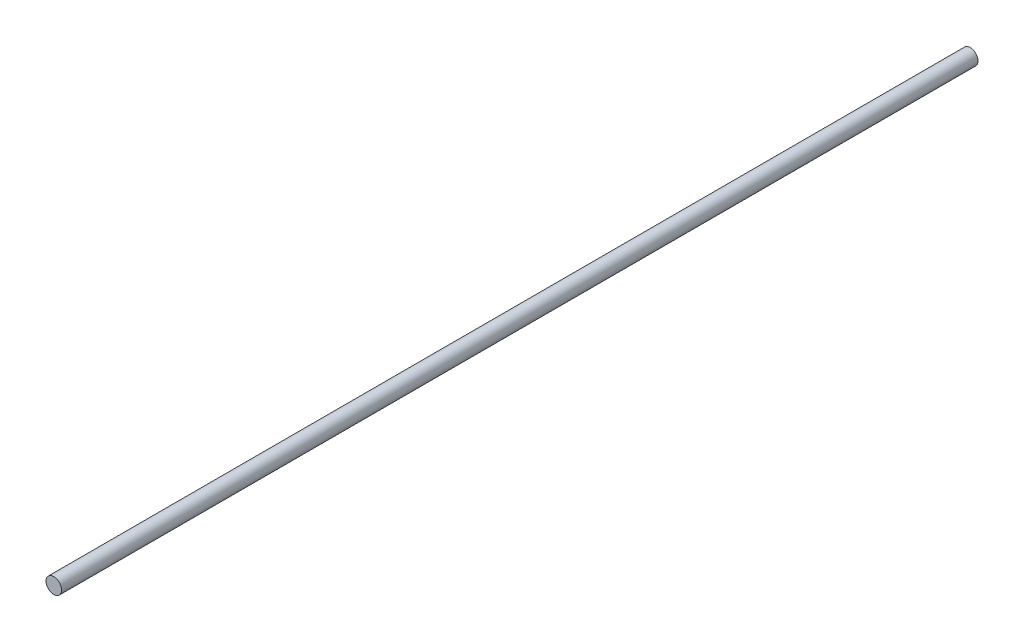
from build123d import *

# Parameters (mm, degrees)
EXTRUDE_START   = 140
SKETCH_1_R      = 1.25
EXTRUDE_1_DEPTH = 147


with BuildPart() as part:
    # 草图1 → 凸台-拉伸1 (new body)
    with BuildSketch(Plane.XY.offset(EXTRUDE_START)):
        with Locations(Location((0, 0, 0), (0, 0, 180))):
            Circle(SKETCH_1_R)
    extrude(amount=EXTRUDE_1_DEPTH)


solid = part.part
